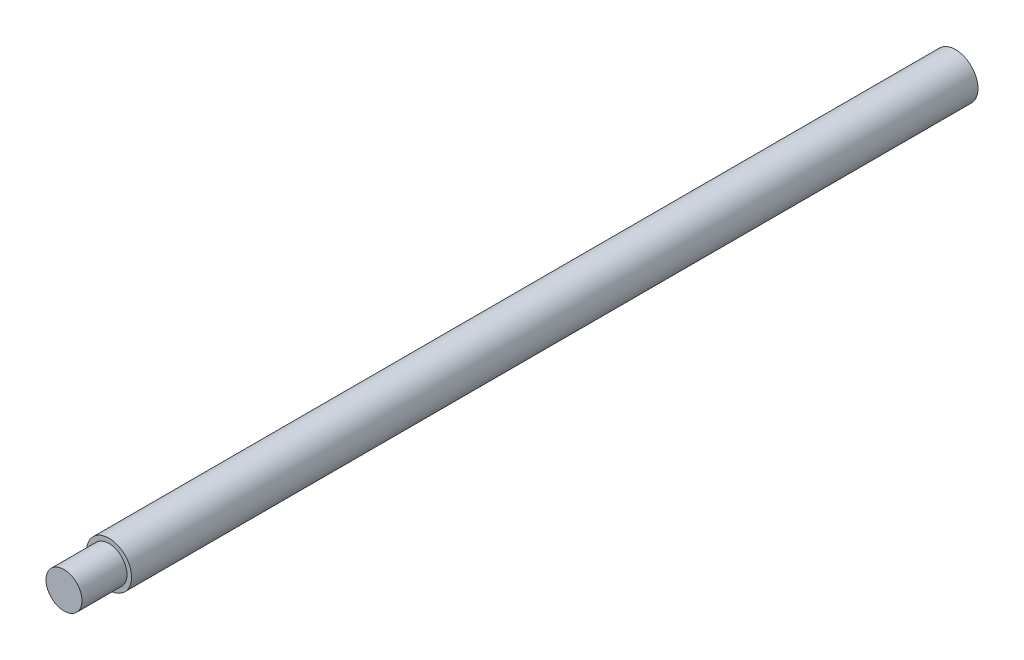
from build123d import *

# Parameters (mm, degrees)
SKETCH1_R                  = 5
BOSS_EXTRUDE1_DEPTH        = 198
OTW_R_GWINTOWANY_M52_D     = 4.2
OTW_R_GWINTOWANY_M52_DEPTH = 20
OTW_R_GWINTOWANY_M52_TIP   = 1.2618073
SZKIC7_R                   = 5.5
SZKIC7_R_2                 = 4
WYTNIJ_WYCI_GNI_CIE1_DEPTH = 10


with BuildPart() as part:
    # Sketch1 → Boss-Extrude1 (new body)
    with BuildSketch(Plane.XY):
        Circle(SKETCH1_R)
    extrude(amount=BOSS_EXTRUDE1_DEPTH)

    # Otwór gwintowany M52
    with Locations(Plane(origin=(0, 0, 0), x_dir=(-1, 0, 0), z_dir=(0, 0, -1))):
        with Locations((0, 0)):
            Hole(OTW_R_GWINTOWANY_M52_D / 2, depth=OTW_R_GWINTOWANY_M52_DEPTH)
            with Locations((0, 0, -(OTW_R_GWINTOWANY_M52_DEPTH + OTW_R_GWINTOWANY_M52_TIP / 2))):  # 118° drill point
                Cone(0, OTW_R_GWINTOWANY_M52_D / 2, OTW_R_GWINTOWANY_M52_TIP, mode=Mode.SUBTRACT)

    # Szkic7 → Wytnij-wyciągnięcie1 (cut)
    with BuildSketch(Plane.XY.offset(198)):
        Circle(SZKIC7_R)
        Circle(SZKIC7_R_2, mode=Mode.SUBTRACT)
    extrude(amount=-WYTNIJ_WYCI_GNI_CIE1_DEPTH, mode=Mode.SUBTRACT)


solid = part.part
